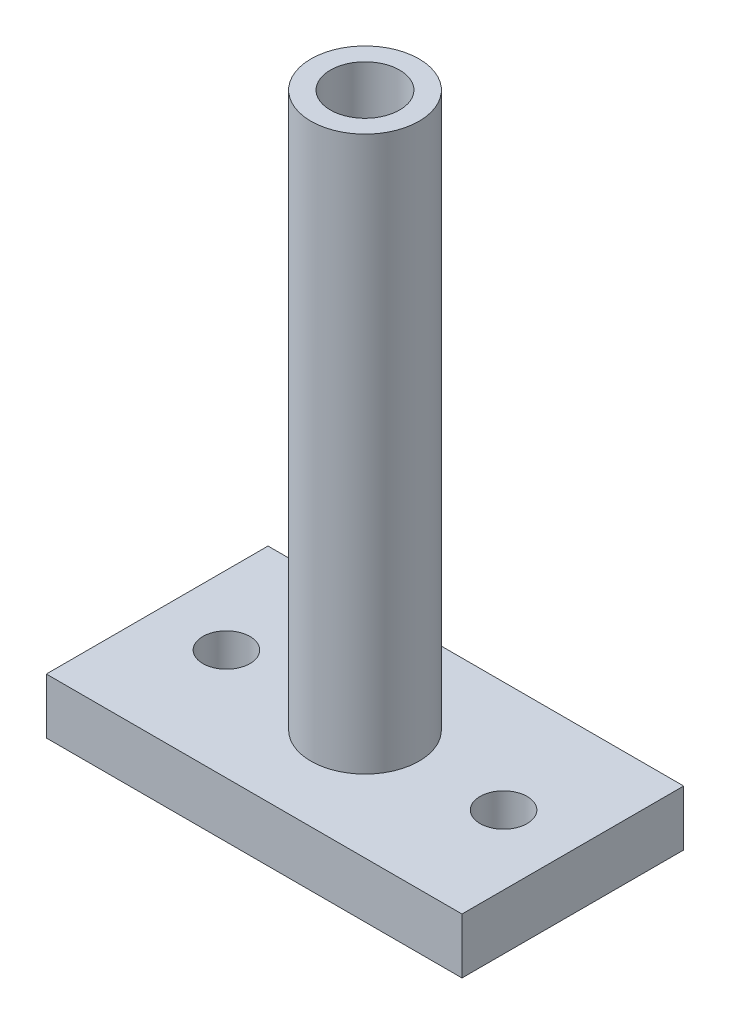
from build123d import *

# Parameters (mm, degrees)
SKETCH_1_W          = 15
SKETCH_1_H          = 8
SKETCH_1_R          = 0.85
EXTRUDE_1_DEPTH     = 2
SKETCH_2_R          = 1.95
EXTRUDE_2_DEPTH     = 20
SKETCH_3_R          = 1.25
CUT_EXTRUDE_1_DEPTH = 10


with BuildPart() as part:
    # 草图1 → 凸台-拉伸1 (new body)
    with BuildSketch(Plane(origin=(0, 0, 0), x_dir=(1, 0, 0), z_dir=(0, 1, 0))):
        with Locations((7.5, 4)):
            Rectangle(SKETCH_1_W, SKETCH_1_H)
        with Locations(Location((2.5, 4, 0), (0, 0, 270))):
            Circle(SKETCH_1_R, mode=Mode.SUBTRACT)
        with Locations(Location((12.5, 4, 0), (0, 0, 90))):
            Circle(SKETCH_1_R, mode=Mode.SUBTRACT)
    extrude(amount=EXTRUDE_1_DEPTH)

    # 草图2 → 凸台-拉伸2 (add)
    with BuildSketch(Plane(origin=(0, 2, 0), x_dir=(1, 0, 0), z_dir=(0, 1, 0))):
        with Locations(Location((7.5, 4, 0), (0, 0, 90))):
            Circle(SKETCH_2_R)
    extrude(amount=EXTRUDE_2_DEPTH)

    # 草图3 → 切除-拉伸1 (cut)
    with BuildSketch(Plane(origin=(0, 22, 0), x_dir=(1, 0, 0), z_dir=(0, 1, 0))):
        with Locations(Location((7.5, 4, 0), (0, 0, 270))):
            Circle(SKETCH_3_R)
    extrude(amount=-CUT_EXTRUDE_1_DEPTH, mode=Mode.SUBTRACT)


solid = part.part
